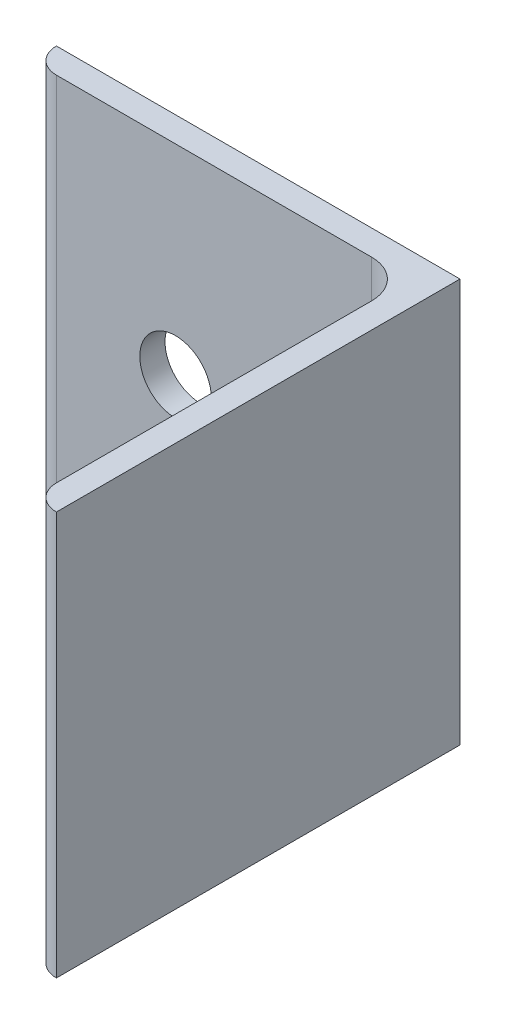
from build123d import *

# Parameters (mm, degrees)
HIERRO_ANGULAR_2_X_2_X_0_125_1_DEPTH = 50.8
CROQUIS3_R                           = 4.5
CORTAR_EXTRUIR1_DEPTH                = 10


with BuildPart() as part:
    # Sketch1 → Hierro angular 2 X 2 X 0.125(1) (new body)
    with BuildSketch(Plane(origin=(0, 0, 0), x_dir=(-1, 0, 0), z_dir=(0, 1, 0))):
        with BuildLine():
            Line((0, 0), (0, 50.8))
            Line((0, 50.8), (0.00508, 50.8))
            ThreePointArc((0.00508, 50.8), (2.246551928, 49.871551928), (3.175, 47.63008))
            Line((3.175, 47.63008), (3.175, 7.9375))
            ThreePointArc((3.175, 7.9375), (4.569903955, 4.569903955), (7.9375, 3.175))
            Line((7.9375, 3.175), (47.63008, 3.175))
            ThreePointArc((47.63008, 3.175), (49.871551928, 2.246551928), (50.8, 0.00508))
            Line((50.8, 0.00508), (50.8, 0))
            Line((50.8, 0), (0, 0))
        make_face()
    extrude(amount=HIERRO_ANGULAR_2_X_2_X_0_125_1_DEPTH)

    # Croquis3 → Cortar-Extruir1 (cut)
    with BuildSketch(Plane.XY.offset(3.175)):
        with Locations((-32.63008, 25.4)):
            Circle(CROQUIS3_R)
    extrude(amount=-CORTAR_EXTRUIR1_DEPTH, mode=Mode.SUBTRACT)


solid = part.part
